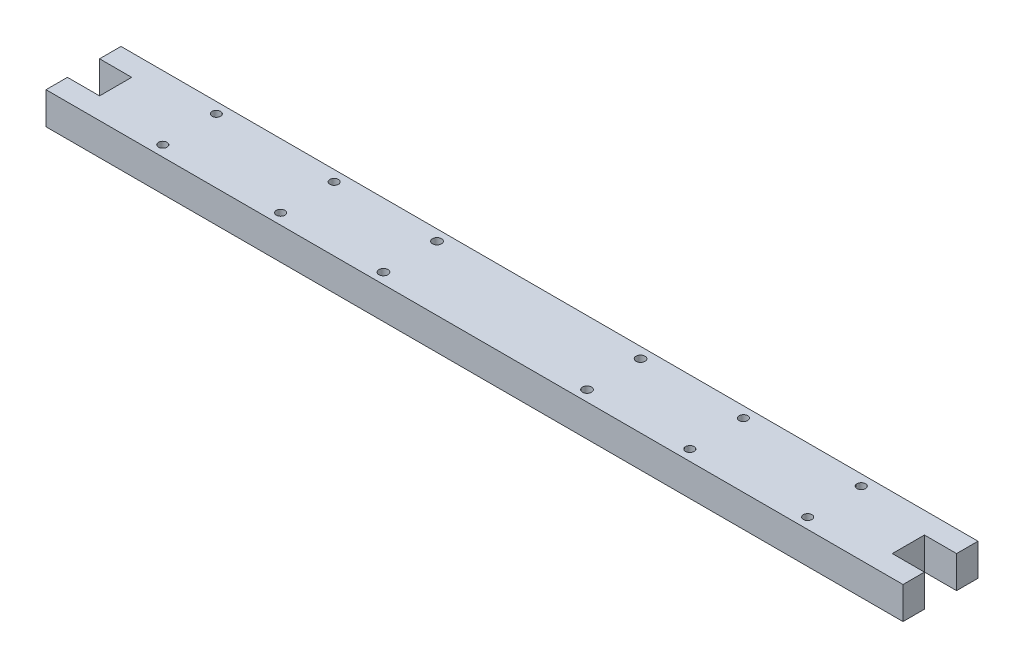
from build123d import *

# Parameters (mm, degrees)
EXTRUDE_1_DEPTH     = 15
SKETCH_5_R          = 2.1
CUT_EXTRUDE_2_DEPTH = 30
SKETCH_6_R          = 2
CUT_EXTRUDE_3_DEPTH = 15


with BuildPart() as part:
    # 草图3 → 凸台-拉伸1 (new body)
    with BuildSketch(Plane(origin=(0, 0, 0), x_dir=(1, 0, 0), z_dir=(0, 1, 0))):
        Polygon((0, 0), (400, 0), (400, 10), (385, 10), (385, 25), (400, 25), (400, 35), (0, 35), (0, 25), (15, 25), (15, 10), (0, 10), align=None)
    extrude(amount=EXTRUDE_1_DEPTH)

    # 草图5 → 切除-拉伸2 (cut)
    with BuildSketch(Plane(origin=(0, 15, 0), x_dir=(1, 0, 0), z_dir=(0, 1, 0))):
        with Locations(Location((152.5, 5, 0), (0, 0, 270))):
            Circle(SKETCH_5_R)
        with Locations(Location((152.5, 30, 0), (0, 0, 270))):
            Circle(SKETCH_5_R)
        with Locations(Location((247.5, 5, 0), (0, 0, 270))):
            Circle(SKETCH_5_R)
        with Locations(Location((247.5, 30, 0), (0, 0, 270))):
            Circle(SKETCH_5_R)
    extrude(amount=-CUT_EXTRUDE_2_DEPTH, mode=Mode.SUBTRACT)

    # 草图6 → 切除-拉伸3 (cut)
    with BuildSketch(Plane(origin=(0, 15, 0), x_dir=(1, 0, 0), z_dir=(0, 1, 0))):
        with Locations(Location((350.5, 5, 0), (0, 0, 270))):
            Circle(SKETCH_6_R)
        with Locations(Location((295.5, 5, 0), (0, 0, 270))):
            Circle(SKETCH_6_R)
        with Locations(Location((350.5, 30, 0), (0, 0, 270))):
            Circle(SKETCH_6_R)
        with Locations(Location((295.5, 30, 0), (0, 0, 270))):
            Circle(SKETCH_6_R)
        with Locations(Location((49.5, 30, 0), (0, 0, 90))):
            Circle(SKETCH_6_R)
        with Locations(Location((104.5, 30, 0), (0, 0, 90))):
            Circle(SKETCH_6_R)
        with Locations(Location((104.5, 5, 0), (0, 0, 90))):
            Circle(SKETCH_6_R)
        with Locations(Location((49.5, 5, 0), (0, 0, 90))):
            Circle(SKETCH_6_R)
    extrude(amount=-CUT_EXTRUDE_3_DEPTH, mode=Mode.SUBTRACT)


solid = part.part
